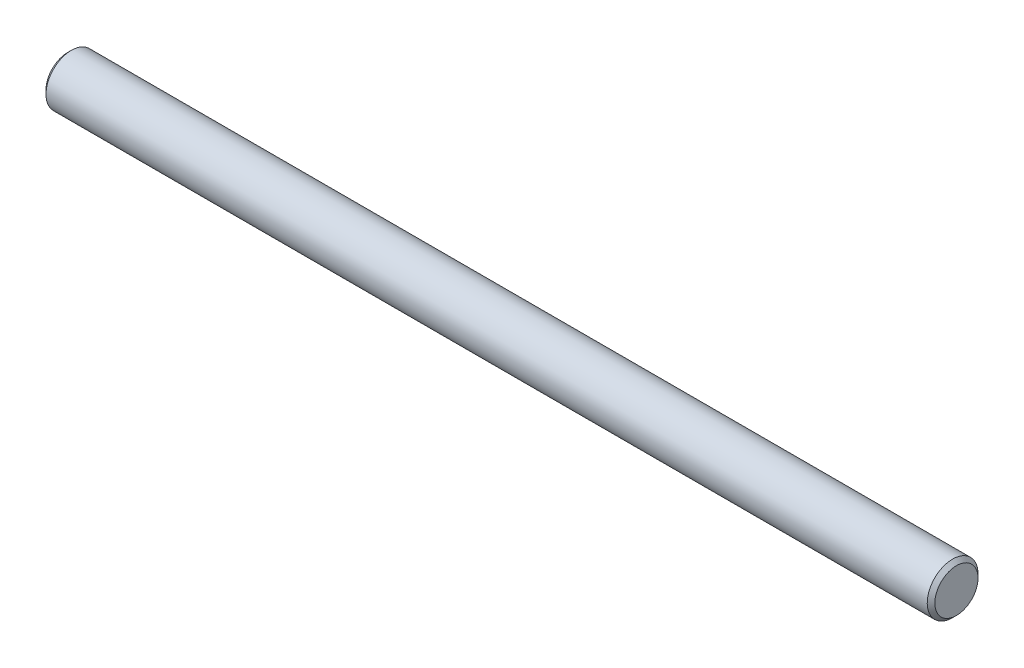
from build123d import *


with BuildPart() as part:
    # Esquisse1 → Révolution1 (revolve)
    with BuildSketch(Plane.XY):
        Polygon((0, 0), (-70, 0), (-70, 1.7), (-69.7, 2), (-0.3, 2), (0, 1.7), align=None)
    revolve(axis=Axis((0, 0, 0), (-1, 0, 0)))


solid = part.part
